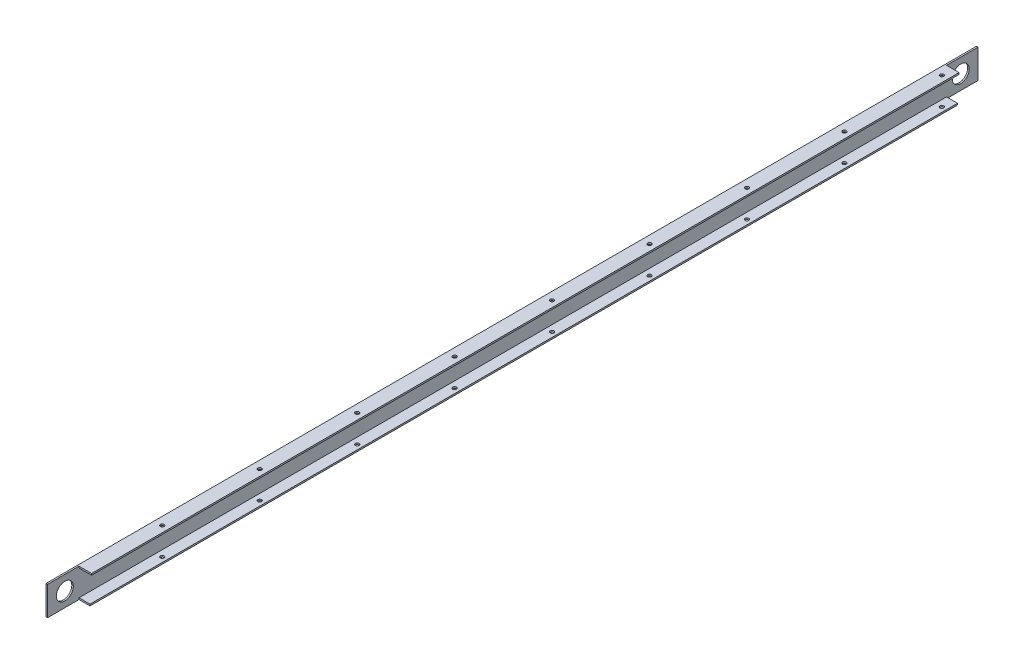
from build123d import *

# Parameters (mm, degrees)
BOSS_EXTRU_1_DEPTH         = 2960
ESQUISSE7_R                = 6
ENL_V_MAT_EXTRU_2_DEPTH    = 2962.718746921
ESQUISSE8_W                = 40
ESQUISSE8_H                = 100
ENL_V_MAT_EXTRU_3_DEPTH    = 2962.718746921
R_P_TITION_LIN_AIRE1_COUNT = 24
R_P_TITION_LIN_AIRE1_PITCH = 310
ESQUISSE9_R                = 27
ENL_V_MAT_EXTRU_4_DEPTH    = 2962.77126058


with BuildPart() as part:
    # Esquisse1 → Boss.-Extru.1 (new body)
    with BuildSketch(Plane.XY):
        Polygon((-3.600291477, 0), (36.399708523, 0), (36.399708523, 5), (1.399708523, 5), (1.399708523, 87), (41.399708523, 87), (41.399708523, 92), (-3.600291477, 92), align=None)
    extrude(amount=BOSS_EXTRU_1_DEPTH)

    # Esquisse7 → Enlèv. mat.-Extru.2 (cut, through all)
    with BuildSketch(Plane(origin=(0, 92, 0), x_dir=(1, 0, 0), z_dir=(0, 1, 0))):
        with Locations(Location((21.399708523, -135, 0), (0, 0, 180))):
            Circle(ESQUISSE7_R)
    enl_v_mat_extru_2 = extrude(amount=-ENL_V_MAT_EXTRU_2_DEPTH, mode=Mode.SUBTRACT)

    # Esquisse8 → Enlèv. mat.-Extru.3 (cut, through all)
    with BuildSketch(Plane(origin=(0, 92, 0), x_dir=(1, 0, 0), z_dir=(0, 1, 0))):
        with Locations((21.399708523, -2910)):
            Rectangle(ESQUISSE8_W, ESQUISSE8_H)
        with Locations((21.399708523, -50)):
            Rectangle(ESQUISSE8_W, ESQUISSE8_H)
    extrude(amount=-ENL_V_MAT_EXTRU_3_DEPTH, mode=Mode.SUBTRACT)

    # Répétition linéaire1: Enlèv. mat.-Extru.2 ×24
    with Locations(*[(0, 0, i * R_P_TITION_LIN_AIRE1_PITCH) for i in range(1, R_P_TITION_LIN_AIRE1_COUNT)]):
        add(enl_v_mat_extru_2, mode=Mode.SUBTRACT)

    # Esquisse9 → Enlèv. mat.-Extru.4 (cut, through all)
    with BuildSketch(Plane.ZY.offset(3.600291477)):
        with Locations(Location((55, 46, 0), (0, 0, 270))):
            Circle(ESQUISSE9_R)
        with Locations(Location((2905, 46, 0), (0, 0, 270))):
            Circle(ESQUISSE9_R)
    extrude(amount=-ENL_V_MAT_EXTRU_4_DEPTH, mode=Mode.SUBTRACT)


solid = part.part
